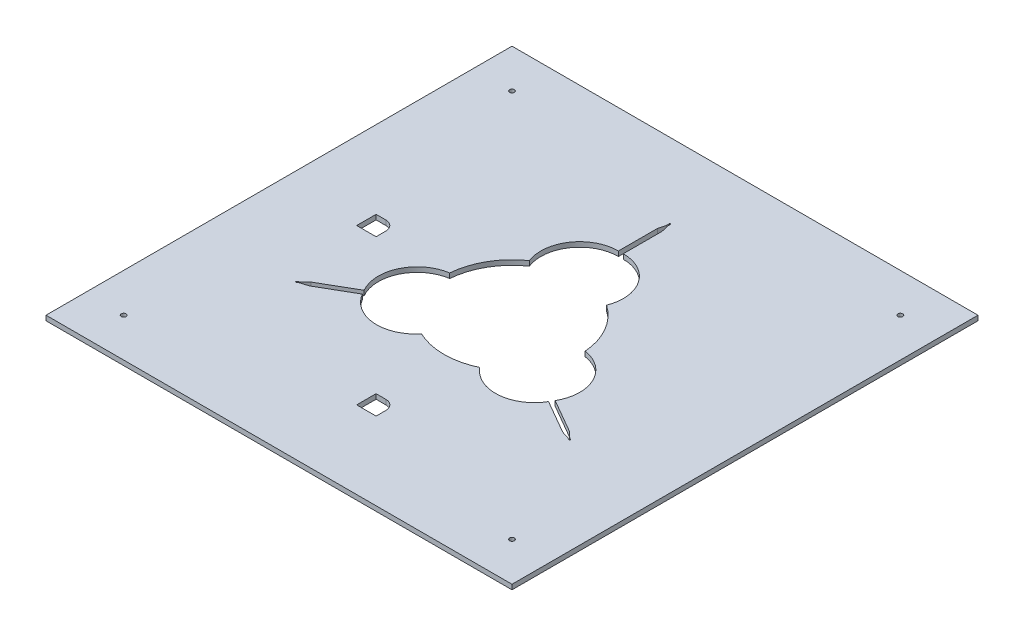
from build123d import *

# Parameters (mm, degrees)
SKETCH1_W           = 609.6
SKETCH1_H           = 609.6
BOSS_EXTRUDE1_DEPTH = 6.35
CUT_EXTRUDE2_DEPTH  = 432.099063441
SKETCH4_W           = 25.4
SKETCH4_H           = 25.4
CUT_EXTRUDE8_DEPTH  = 432.099063441
FILLET4_R           = 12.7
FILLET5_R           = 12.7
SKETCH5_R           = 3.175
CUT_EXTRUDE9_DEPTH  = 432.099063441


with BuildPart() as part:
    # Sketch1 → Boss-Extrude1 (new body)
    with BuildSketch(Plane(origin=(0, 0, 0), x_dir=(1, 0, 0), z_dir=(0, 1, 0))):
        Rectangle(SKETCH1_W, SKETCH1_H)
    extrude(amount=BOSS_EXTRUDE1_DEPTH)

    # Sketch3 → Cut-Extrude2 (cut, through all)
    with BuildSketch(Plane(origin=(0, 0, 0), x_dir=(1, 0, 0), z_dir=(0, 1, 0))):
        with BuildLine():
            Line((-3.175, 193.254689298), (-3.175, 142.454689298))
            ThreePointArc((-3.175, 142.454689298), (-45.125573361, 120.304111538), (-50.492310608, 73.169232396))
            ThreePointArc((-50.492310608, 73.169232396), (-76.989658396, 44.45), (-88.612569335, 7.143007484))
            ThreePointArc((-88.612569335, 7.143007484), (-126.749203452, -21.072162878), (-124.95687982, -68.477713992))
            Line((-124.95687982, -68.477713992), (-168.950970332, -93.877713992))
            Line((-168.950970332, -93.877713992), (-173.656481646, -98.42752932))
            Line((-173.656481646, -98.42752932), (-176.009237303, -100.702436985))
            Line((-176.009237303, -100.702436985), (-179.308794092, -102.607436985))
            ThreePointArc((-179.308794092, -102.607436985), (-179.599326756, -103.691719649), (-178.515044092, -103.982252313))
            Line((-178.515044092, -103.982252313), (-175.215487303, -102.077252313))
            Line((-175.215487303, -102.077252313), (-172.068981646, -101.177159977))
            Line((-172.068981646, -101.177159977), (-165.775970332, -99.376975306))
            Line((-165.775970332, -99.376975306), (-121.78187982, -73.976975306))
            ThreePointArc((-121.78187982, -73.976975306), (-81.623630091, -99.23194866), (-38.120258727, -80.31223988))
            ThreePointArc((-38.120258727, -80.31223988), (0, -88.9), (38.120258727, -80.31223988))
            ThreePointArc((38.120258727, -80.31223988), (81.623630091, -99.23194866), (121.78187982, -73.976975306))
            Line((121.78187982, -73.976975306), (165.775970332, -99.376975306))
            Line((165.775970332, -99.376975306), (172.068981646, -101.177159977))
            Line((172.068981646, -101.177159977), (175.215487303, -102.077252313))
            Line((175.215487303, -102.077252313), (178.515044092, -103.982252313))
            ThreePointArc((178.515044092, -103.982252313), (179.599326756, -103.691719649), (179.308794092, -102.607436985))
            Line((179.308794092, -102.607436985), (176.009237303, -100.702436985))
            Line((176.009237303, -100.702436985), (173.656481646, -98.42752932))
            Line((173.656481646, -98.42752932), (168.950970332, -93.877713992))
            Line((168.950970332, -93.877713992), (124.95687982, -68.477713992))
            ThreePointArc((124.95687982, -68.477713992), (126.749203452, -21.072162878), (88.612569335, 7.143007484))
            ThreePointArc((88.612569335, 7.143007484), (76.989658396, 44.45), (50.492310608, 73.169232396))
            ThreePointArc((50.492310608, 73.169232396), (45.125573361, 120.304111538), (3.175, 142.454689298))
            Line((3.175, 142.454689298), (3.175, 193.254689298))
            Line((3.175, 193.254689298), (1.5875, 199.604689298))
            Line((1.5875, 199.604689298), (0.79375, 202.779689298))
            Line((0.79375, 202.779689298), (0.79375, 206.589689298))
            ThreePointArc((0.79375, 206.589689298), (0, 207.383439298), (-0.79375, 206.589689298))
            Line((-0.79375, 206.589689298), (-0.79375, 202.779689298))
            Line((-0.79375, 202.779689298), (-1.5875, 199.604689298))
            Line((-1.5875, 199.604689298), (-3.175, 193.254689298))
        make_face()
    extrude(amount=CUT_EXTRUDE2_DEPTH, mode=Mode.SUBTRACT)

    # Sketch4 → Cut-Extrude8 (cut, through all)
    with BuildSketch(Plane(origin=(0, 0, 0), x_dir=(1, 0, 0), z_dir=(0, 1, 0))):
        with Locations((12.7, -190.5)):
            Rectangle(SKETCH4_W, SKETCH4_H)
        with Locations((-190.5, 12.7)):
            Rectangle(SKETCH4_W, SKETCH4_H)
    extrude(amount=CUT_EXTRUDE8_DEPTH, mode=Mode.SUBTRACT)

    # Fillet4
    fillet4_edges = [part.edges().sort_by_distance(p)[0] for p in [
        (-177.8, 3.175, -25.4),
    ]]
    fillet(fillet4_edges, radius=FILLET4_R)

    # Fillet5
    fillet5_edges = [part.edges().sort_by_distance(p)[0] for p in [
        (25.4, 3.175, 177.8),
    ]]
    fillet(fillet5_edges, radius=FILLET5_R)

    # Sketch5 → Cut-Extrude9 (cut, through all)
    with BuildSketch(Plane(origin=(0, 6.35, 0), x_dir=(1, 0, 0), z_dir=(0, 1, 0))):
        with Locations(Location((-254, 254, 0), (0, 0, 270))):
            Circle(SKETCH5_R)
        with Locations(Location((254, 254, 0), (0, 0, 270))):
            Circle(SKETCH5_R)
        with Locations(Location((254, -254, 0), (0, 0, 270))):
            Circle(SKETCH5_R)
        with Locations(Location((-254, -254, 0), (0, 0, 270))):
            Circle(SKETCH5_R)
    extrude(amount=-CUT_EXTRUDE9_DEPTH, mode=Mode.SUBTRACT)


solid = part.part
